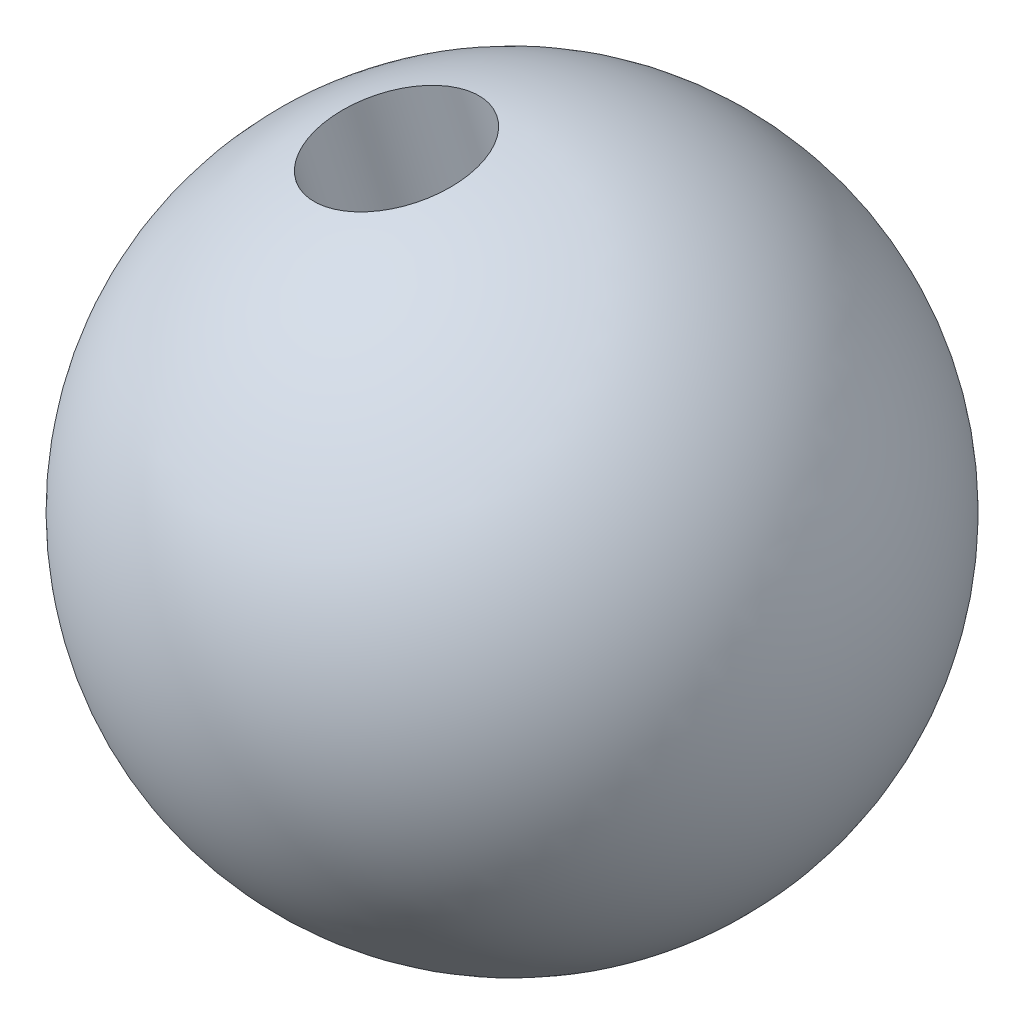
from build123d import *


with BuildPart() as part:
    # Schizzo1 → Rivoluzione1 (revolve)
    with BuildSketch(Plane.XY):
        with BuildLine():
            Line((0.663556424, 14.985315908), (-0.663556424, -14.985315908))
            ThreePointArc((-0.663556424, -14.985315908), (-14.985315908, 0.663556424), (0.663556424, 14.985315908))
        make_face()
    revolve(axis=Axis((0.663556424, 14.985315908, 0), (-0.044237094932313946, -0.999021060554756, 0)))

    # Schizzo2 → Preforo da maschiare M8x1.25-1 (revolve, cut)
    with BuildSketch(Plane(origin=(-2.901516903, 14.502881143, 2.499527597), x_dir=(-0.680275757507728, -0.2545587908916996, 0.6873315908111914), z_dir=(0.7069710060228755, 0.019595746630497193, 0.7069710060228757))):
        Polygon((0, 0), (0, 15), (3.4, 12.957073895), (3.4, 0), align=None)
    revolve(axis=Axis((-4.129825725, 20.642434161, 3.557660946), (0.1934344601933443, -0.9668587428853035, -0.16663517310568068)), mode=Mode.SUBTRACT)


solid = part.part
